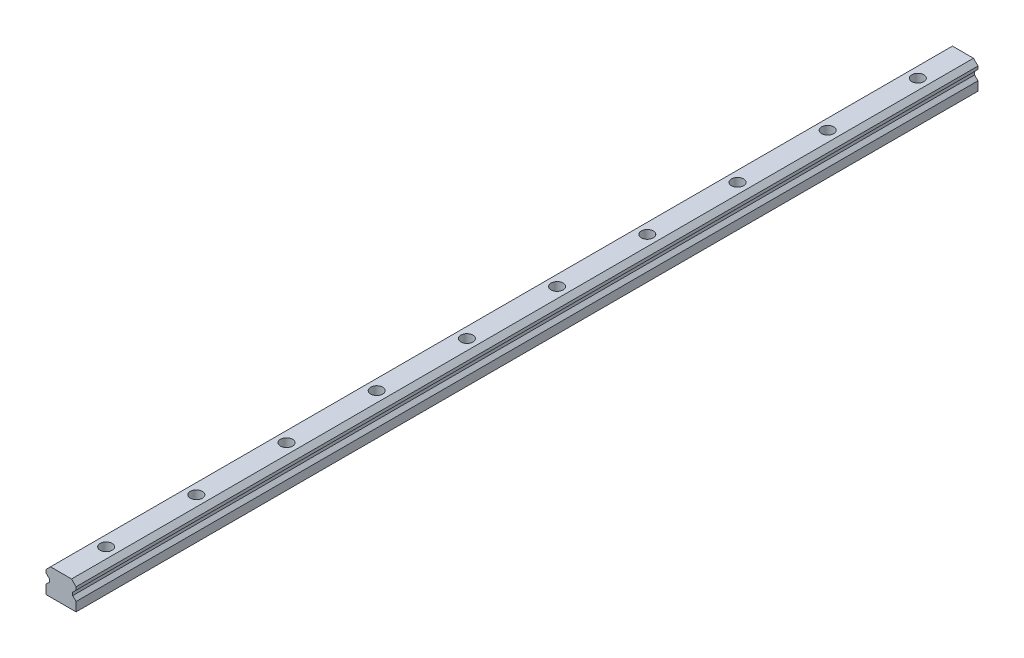
from build123d import *

# Parameters (mm, degrees)
BOSS_EXTRUDE1_DEPTH = 600
SKETCH2_R           = 4
CUT_EXTRUDE1_DEPTH  = 26


with BuildPart() as part:
    # Sketch1 → Boss-Extrude1 (new body)
    with BuildSketch(Plane.XY):
        Polygon((-10, 0), (0, 0), (0, 17.5), (-7, 17.5), (-10, 14.5), (-10, 12.5), (-7.75, 10.25), (-7.75, 8.25), (-10, 6), align=None)
        Polygon((0, 17.5), (0, 0), (10, 0), (10, 6), (7.75, 8.25), (7.75, 10.25), (10, 12.5), (10, 14.5), (7, 17.5), align=None)
    extrude(amount=-BOSS_EXTRUDE1_DEPTH)

    # Sketch2 → Cut-Extrude1 (cut)
    with BuildSketch(Plane(origin=(0, 17.5, 0), x_dir=(1, 0, 0), z_dir=(0, 1, 0))):
        with Locations(Location((0, 30, 0), (0, 0, 270))):
            Circle(SKETCH2_R)
        with Locations(Location((0, 90, 0), (0, 0, 270))):
            Circle(SKETCH2_R)
        with Locations(Location((0, 150, 0), (0, 0, 270))):
            Circle(SKETCH2_R)
        with Locations(Location((0, 210, 0), (0, 0, 270))):
            Circle(SKETCH2_R)
        with Locations(Location((0, 270, 0), (0, 0, 270))):
            Circle(SKETCH2_R)
        with Locations(Location((0, 330, 0), (0, 0, 270))):
            Circle(SKETCH2_R)
        with Locations(Location((0, 390, 0), (0, 0, 270))):
            Circle(SKETCH2_R)
        with Locations(Location((0, 450, 0), (0, 0, 270))):
            Circle(SKETCH2_R)
        with Locations(Location((0, 510, 0), (0, 0, 270))):
            Circle(SKETCH2_R)
        with Locations(Location((0, 570, 0), (0, 0, 270))):
            Circle(SKETCH2_R)
    extrude(amount=-CUT_EXTRUDE1_DEPTH, mode=Mode.SUBTRACT)


solid = part.part
